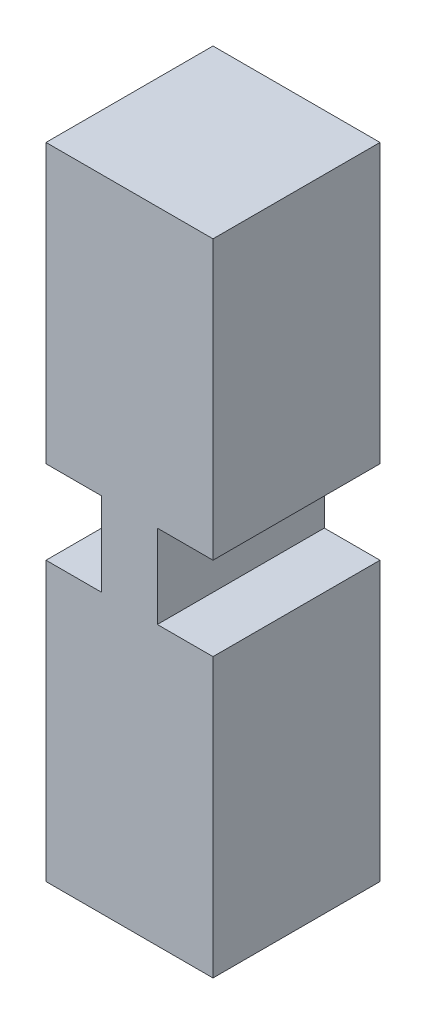
from build123d import *

# Parameters (mm, degrees)
SKETCH1_W           = 60
SKETCH1_H           = 100
BOSS_EXTRUDE1_DEPTH = 30
SKETCH2_W           = 60
SKETCH2_H           = 100
BOSS_EXTRUDE2_DEPTH = 30
SKETCH3_W           = 20
SKETCH3_H           = 30
BOSS_EXTRUDE3_DEPTH = 30
SKETCH4_W           = 1.6
SKETCH4_H           = 3
BOSS_EXTRUDE4_DEPTH = 28.4


with BuildPart() as part:
    # Sketch1 → Boss-Extrude1 (new, symmetric)
    with BuildSketch(Plane.XY):
        with Locations((0, -65)):
            Rectangle(SKETCH1_W, SKETCH1_H)
    extrude(amount=BOSS_EXTRUDE1_DEPTH, both=True)



with BuildPart() as body_2:
    # Sketch2 → Boss-Extrude2 (new, symmetric)
    with BuildSketch(Plane.XY):
        with Locations((0, 65)):
            Rectangle(SKETCH2_W, SKETCH2_H)
    extrude(amount=BOSS_EXTRUDE2_DEPTH, both=True)


with BuildPart() as part_1:
    add(part.part)

    add(body_2.part)  # Boss-Extrude3 merges body 2
    # Sketch3 → Boss-Extrude3 (add, symmetric)
    with BuildSketch(Plane.XY):
        Rectangle(SKETCH3_W, SKETCH3_H)
    extrude(amount=BOSS_EXTRUDE3_DEPTH, both=True)

    # Sketch4 → Boss-Extrude4 (add, symmetric)
    with BuildSketch(Plane.XY):
        with Locations((-10.8, -11.9)):
            Rectangle(SKETCH4_W, SKETCH4_H)
    extrude(amount=BOSS_EXTRUDE4_DEPTH, both=True)


solid = part_1.part
